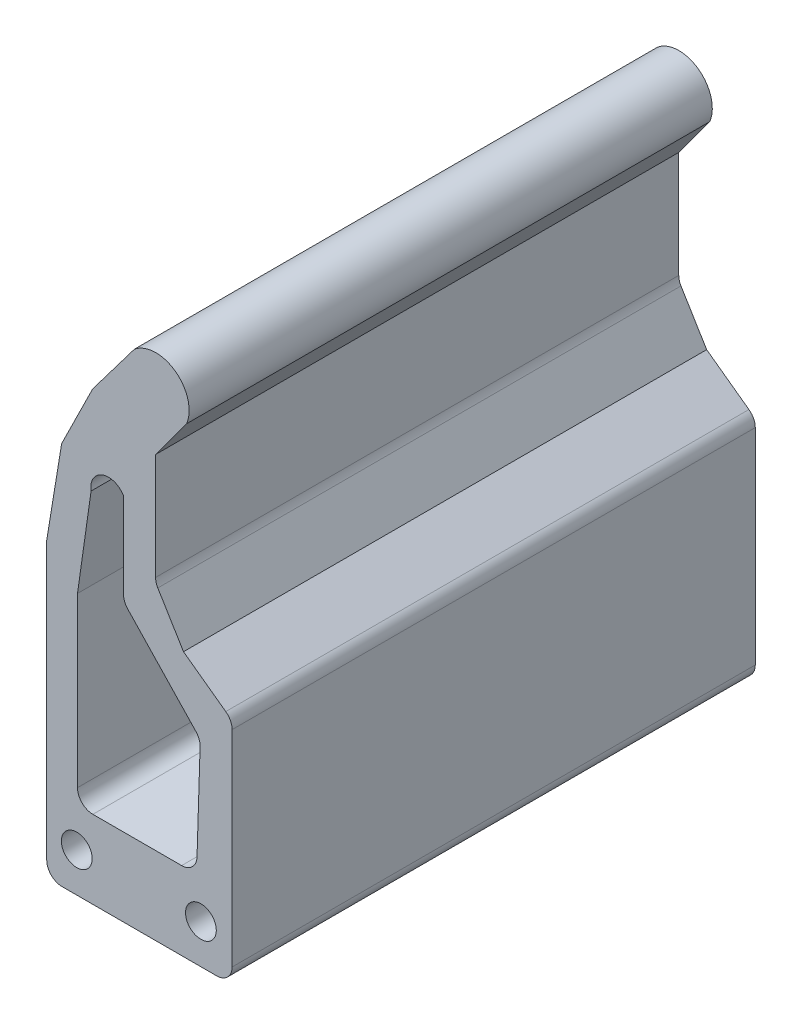
from build123d import *

# Parameters (mm, degrees)
BOSS_EXTRUDE1_DEPTH = 34
CUT_EXTRUDE1_DEPTH  = 32
SKETCH3_R           = 1
CUT_EXTRUDE2_DEPTH  = 32
FILLET2_R           = 1


with BuildPart() as part:
    # Sketch1 → Boss-Extrude1 (new body)
    with BuildSketch(Plane.XY.offset(40)):
        with BuildLine():
            Line((-300, 367), (-300, 348))
            Line((-300, 348), (-287.95160644, 348))
            Line((-287.95160644, 348), (-287.95160644, 362.871836257))
            Line((-287.95160644, 362.871836257), (-291.110931396, 365.166412354))
            Line((-291.110931396, 365.166412354), (-292.925810618, 368.159105691))
            Line((-292.925810618, 368.159105691), (-292.925810618, 375.359105691))
            Line((-292.925810618, 375.359105691), (-290.910509572, 378.097455869))
            ThreePointArc((-290.910509572, 378.097455869), (-291.625724396, 380.675408146), (-294.299987793, 380.600006104))
            Line((-294.299987793, 380.600006104), (-297.012375964, 377.009330623))
            Line((-297.012375964, 377.009330623), (-299.029605392, 372.921007879))
            Line((-299.029605392, 372.921007879), (-300, 367))
        make_face()
    extrude(amount=BOSS_EXTRUDE1_DEPTH)

    # Sketch2 → Cut-Extrude1 (cut)
    with BuildSketch(Plane.XY.offset(74)):
        with BuildLine():
            Line((-297.116612998, 371.207677878), (-298, 365))
            Line((-298, 365), (-298, 353.070416706))
            Line((-298, 353.070416706), (-290.26344591, 353.070416706))
            Line((-290.26344591, 353.070416706), (-290.018829346, 360.778991699))
            Line((-290.018829346, 360.778991699), (-295.010009766, 366.046598155))
            Line((-295.010009766, 366.046598155), (-295.010009766, 371.995180703))
            ThreePointArc((-295.010009766, 371.995180703), (-296.391652801, 372.479756418), (-297.116612998, 371.207677878))
        make_face()
    extrude(amount=-CUT_EXTRUDE1_DEPTH, mode=Mode.SUBTRACT)

    # Sketch3 → Cut-Extrude2 (cut)
    with BuildSketch(Plane.XY.offset(74)):
        with Locations((-298.046417962, 350.546056216)):
            Circle(SKETCH3_R)
        with Locations((-289.979523898, 350.546056216)):
            Circle(SKETCH3_R)
    extrude(amount=-CUT_EXTRUDE2_DEPTH, mode=Mode.SUBTRACT)

    # Fillet2
    fillet2_edges = [part.edges().sort_by_distance(p)[0] for p in [
        (-292.925810618, 368.159105691, 57),
        (-287.95160644, 362.871836257, 57),
        (-287.95160644, 348, 57),
        (-300, 348, 57),
        (-295.010009766, 366.046598155, 58),
        (-290.018829346, 360.778991699, 58),
        (-290.26344591, 353.070416706, 58),
        (-298, 353.070416706, 58),
    ]]
    fillet(fillet2_edges, radius=FILLET2_R)


solid = part.part
